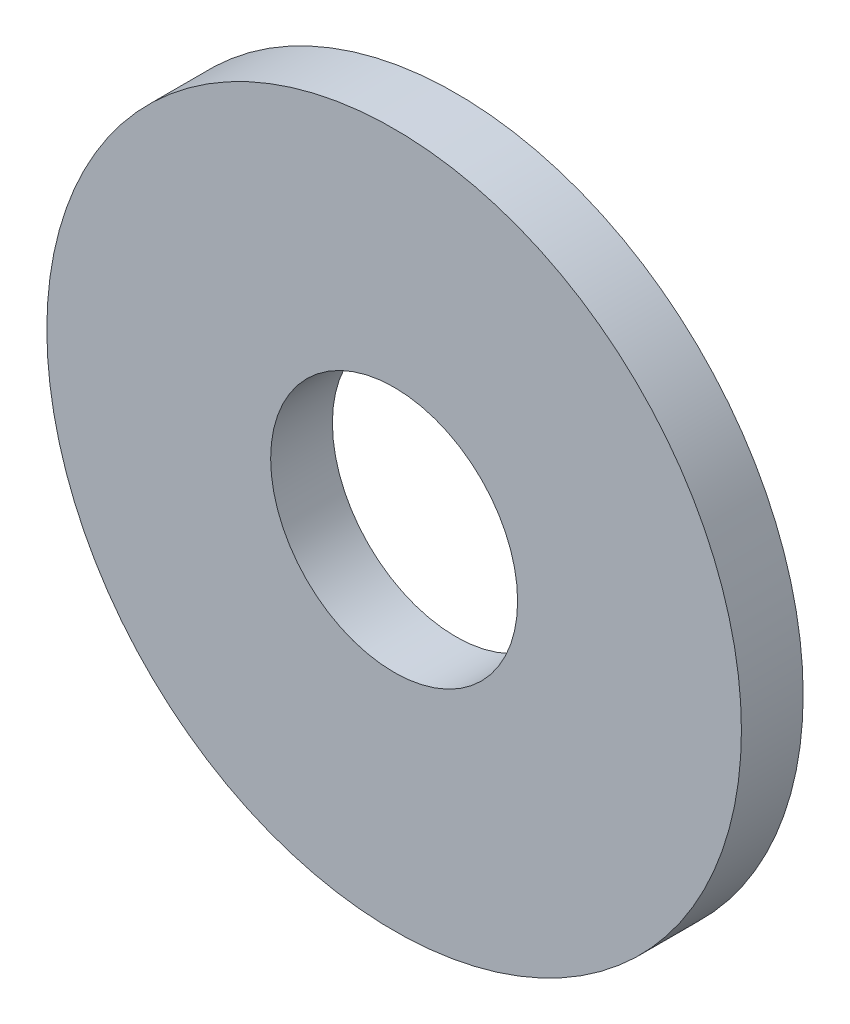
from build123d import *

# Parameters (mm, degrees)
RING_SKETCH_R      = 4.5
RING_SKETCH_R_2    = 1.6
RING_EXTRUDE_DEPTH = 0.8


with BuildPart() as part:
    # Ring Sketch → Ring Extrude (new body)
    with BuildSketch(Plane.XY):
        Circle(RING_SKETCH_R)
        Circle(RING_SKETCH_R_2, mode=Mode.SUBTRACT)
    extrude(amount=RING_EXTRUDE_DEPTH)


solid = part.part
